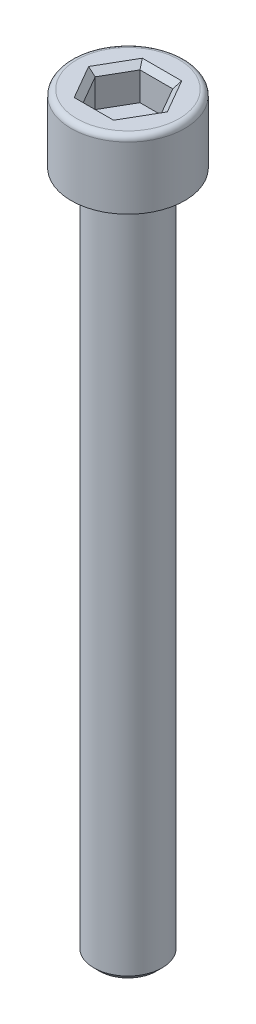
from build123d import *

# Parameters (mm, degrees)
ESBO_O1_R                = 3
RESSALTO_EXTRUS_O1_DEPTH = 60
ESBO_O2_R                = 5
RESSALTO_EXTRUS_O2_DEPTH = 6
FILETE1_R                = 0.5
CORTE_EXTRUS_O1_DEPTH    = 3
CHANFRO3_SIZE            = 0.5
CHANFRO4_SIZE            = 0.5


with BuildPart() as part:
    # Esboço1 → Ressalto-extrusão1 (new body)
    with BuildSketch(Plane(origin=(0, 0, 0), x_dir=(1, 0, 0), z_dir=(0, 1, 0))):
        with Locations(Location((0, 0, 0), (0, 0, 270))):
            Circle(ESBO_O1_R)
    extrude(amount=-RESSALTO_EXTRUS_O1_DEPTH)

    # Esboço2 → Ressalto-extrusão2 (add)
    with BuildSketch(Plane(origin=(0, 0, 0), x_dir=(1, 0, 0), z_dir=(0, 1, 0))):
        with Locations(Location((0, 0, 0), (0, 0, 270))):
            Circle(ESBO_O2_R)
    extrude(amount=RESSALTO_EXTRUS_O2_DEPTH)

    # Filete1
    filete1_edges = [part.edges().sort_by_distance(p)[0] for p in [
        (0, 6, -5),
    ]]
    fillet(filete1_edges, radius=FILETE1_R)

    # Esboço3 → Corte-extrusão1 (cut)
    with BuildSketch(Plane(origin=(0, 6, 0), x_dir=(1, 0, 0), z_dir=(0, 1, 0))):
        Polygon((2.886751346, 0), (1.443375673, 2.5), (-1.443375673, 2.5), (-2.886751346, 0), (-1.443375673, -2.5), (1.443375673, -2.5), align=None)
    extrude(amount=-CORTE_EXTRUS_O1_DEPTH, mode=Mode.SUBTRACT)

    # Chanfro3
    chanfro3_edges = [part.edges().sort_by_distance(p)[0] for p in [
        (2.165063509, 6, 1.25),
        (2.165063509, 6, -1.25),
        (0, 6, -2.5),
        (-2.165063509, 6, -1.25),
        (-2.165063509, 6, 1.25),
        (0, 6, 2.5),
    ]]
    chamfer(chanfro3_edges, length=CHANFRO3_SIZE)

    # Chanfro4
    chanfro4_edges = [part.edges().sort_by_distance(p)[0] for p in [
        (0, -60, -3),
    ]]
    chamfer(chanfro4_edges, length=CHANFRO4_SIZE)


solid = part.part
